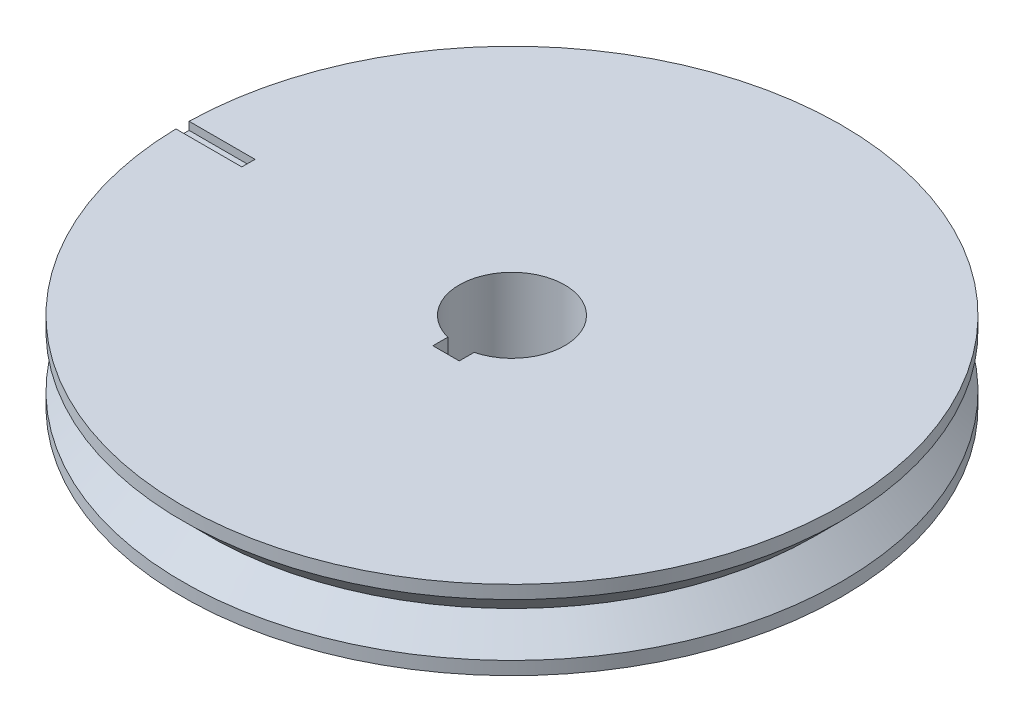
from build123d import *

# Parameters (mm, degrees)
CUT_EXTRUDE1_DEPTH = 180.30421077
CUT_EXTRUDE3_START = -3
CUT_EXTRUDE3_DEPTH = 3


with BuildPart() as part:
    # Sketch1 → Revolve1 (revolve)
    with BuildSketch(Plane.XY):
        Polygon((0, 15), (125, 15), (125, 10), (115, 0), (125, -10), (125, -15), (0, -15), align=None)
    revolve(axis=Axis((0, -15, 0), (0, -1, 0)))

    # Sketch2 → Cut-Extrude1 (cut, through all)
    with BuildSketch(Plane(origin=(0, 15, 0), x_dir=(-1, 0, 0), z_dir=(0, 1, 0))):
        with BuildLine():
            Line((-5, 19.364916731), (-5, 25))
            Line((-5, 25), (5, 25))
            Line((5, 25), (5, 19.364916731))
            ThreePointArc((5, 19.364916731), (0, -20), (-5, 19.364916731))
        make_face()
    extrude(amount=-CUT_EXTRUDE1_DEPTH, mode=Mode.SUBTRACT)

    # Sketch3 → Cut-Extrude3 (cut)
    with BuildSketch(Plane(origin=(0, 15, 0), x_dir=(-1, 0, 0), z_dir=(0, 1, 0)).offset(CUT_EXTRUDE3_START)):
        with BuildLine():
            Line((99.974997499, -2.5), (124.974997499, -2.5))
            ThreePointArc((124.974997499, -2.5), (125, 0), (124.974997499, 2.5))
            Line((124.974997499, 2.5), (99.974997499, 2.5))
            Line((99.974997499, 2.5), (99.974997499, -2.5))
        make_face()
    extrude(amount=CUT_EXTRUDE3_DEPTH, mode=Mode.SUBTRACT)


solid = part.part
